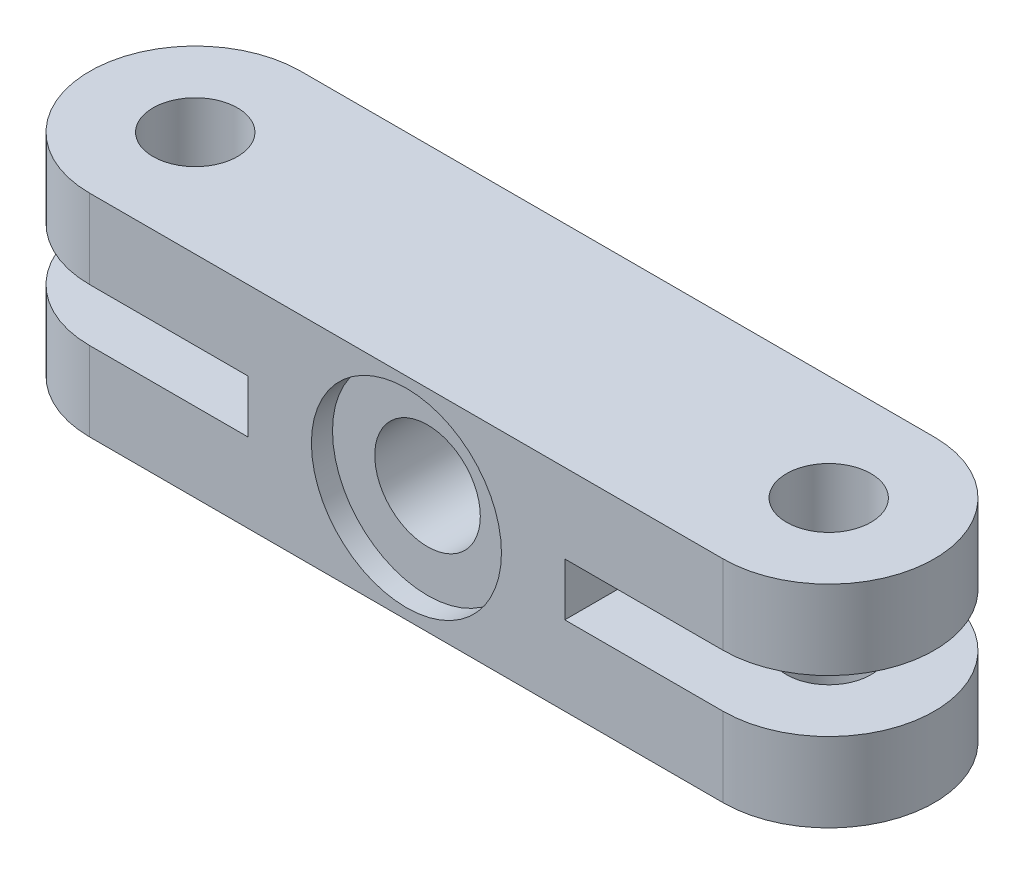
from build123d import *

# Parameters (mm, degrees)
SKETCH_1_R                = 4
EXTRUDE_1_DEPTH           = 10
SKETCH_2_W                = 25
SKETCH_2_H                = 5
CUT_EXTRUDE_1_DEPTH       = 46.82575695
HOLE_WIZARD_1_D           = 10
HOLE_WIZARD_1_CBORE_D     = 18
HOLE_WIZARD_1_CBORE_DEPTH = 2


with BuildPart() as part:
    # 草图1 → 凸台-拉伸1 (new, symmetric)
    with BuildSketch(Plane(origin=(0, 0, 0), x_dir=(1, 0, 0), z_dir=(0, 1, 0))):
        with BuildLine():
            Line((-30, 10), (30, 10))
            ThreePointArc((30, 10), (40, 0), (30, -10))
            Line((30, -10), (-30, -10))
            ThreePointArc((-30, -10), (-40, 0), (-30, 10))
        make_face()
        with Locations(Location((-30, 0, 0), (0, 0, 270))):
            Circle(SKETCH_1_R, mode=Mode.SUBTRACT)
        with Locations(Location((30, 0, 0), (0, 0, 270))):
            Circle(SKETCH_1_R, mode=Mode.SUBTRACT)
    extrude(amount=EXTRUDE_1_DEPTH, both=True)

    # 草图2 → 切除-拉伸1 (cut, through all)
    with BuildSketch(Plane.XY.offset(10)):
        with Locations((27.5, 0)):
            Rectangle(SKETCH_2_W, SKETCH_2_H)
        with Locations((-27.5, 0)):
            Rectangle(SKETCH_2_W, SKETCH_2_H)
    extrude(amount=-CUT_EXTRUDE_1_DEPTH, mode=Mode.SUBTRACT)

    # 孔1 (through all)
    with Locations(Plane.XY.offset(10)):
        with Locations((0, 0)):
            CounterBoreHole(HOLE_WIZARD_1_D / 2, HOLE_WIZARD_1_CBORE_D / 2, HOLE_WIZARD_1_CBORE_DEPTH)


solid = part.part
